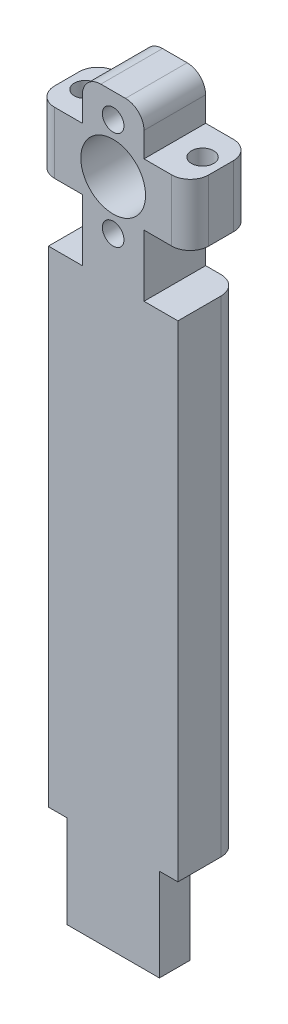
from build123d import *

# Parameters (mm, degrees)
SKETCH_1_W          = 7.5
SKETCH_1_H          = 10
SKETCH_1_W_2        = 10
SKETCH_1_H_2        = 7
EXTRUDE_1_DEPTH     = 10
CUT_EXTRUDE_1_REACH = 25.351
SKETCH_2_R          = 1.8
CUT_EXTRUDE_2_REACH = 23.937
SKETCH_3_R          = 5.25
FILLET_1_R          = 3
CUT_EXTRUDE_4_REACH = 23.937
SKETCH_5_R          = 1.75
SKETCH_6_W          = 15
SKETCH_6_H          = 10
EXTRUDE_2_DEPTH     = 93.8
SKETCH_7_W          = 21
SKETCH_7_H          = 78.8
EXTRUDE_3_DEPTH     = 10
FILLET_2_R          = 3
SKETCH_8_W          = 15
SKETCH_8_H          = 15
CUT_EXTRUDE_5_DEPTH = 5
FILLET_3_R          = 3


with BuildPart() as part:
    # 草图1 → 凸台-拉伸1 (new body)
    with BuildSketch(Plane.XY):
        with Locations((-8.75, 0)):
            Rectangle(SKETCH_1_W, SKETCH_1_H)
        Rectangle(SKETCH_1_W_2, SKETCH_1_H)
        with Locations((0, 8.5)):
            Rectangle(SKETCH_1_W_2, SKETCH_1_H_2)
        with Locations((8.75, 0)):
            Rectangle(SKETCH_1_W, SKETCH_1_H)
        with Locations((0, -10)):
            Rectangle(SKETCH_1_W_2, SKETCH_1_H)
    extrude(amount=EXTRUDE_1_DEPTH)

    # 草图2 → 切除-拉伸1 (cut, up to next)
    with BuildSketch(Plane.XZ.offset(5), mode=Mode.PRIVATE) as cut_extrude_1_sk1:
        with Locations(Location((-9.5, 5, 0), (0, 0, 270))):
            Circle(SKETCH_2_R)
    cut_extrude_1_tool1 = extrude(cut_extrude_1_sk1.sketch, amount=-CUT_EXTRUDE_1_REACH, mode=Mode.PRIVATE) & part.part
    # 草图2 → 切除-拉伸1 (cut, up to next)
    with BuildSketch(Plane.XZ.offset(5), mode=Mode.PRIVATE) as cut_extrude_1_sk2:
        with Locations(Location((9.5, 5, 0), (0, 0, 90))):
            Circle(SKETCH_2_R)
    cut_extrude_1_tool2 = extrude(cut_extrude_1_sk2.sketch, amount=-CUT_EXTRUDE_1_REACH, mode=Mode.PRIVATE) & part.part
    add(cut_extrude_1_tool1.solids().sort_by_distance((-9.5, -5, 5))[0], mode=Mode.SUBTRACT)
    add(cut_extrude_1_tool2.solids().sort_by_distance((9.5, -5, 5))[0], mode=Mode.SUBTRACT)

    # 草图3 → 切除-拉伸2 (cut, up to next)
    with BuildSketch(Plane(origin=(0, 0, 0), x_dir=(-1, 0, 0), z_dir=(0, 0, -1)), mode=Mode.PRIVATE) as cut_extrude_2_sk1:
        Circle(SKETCH_3_R)
    cut_extrude_2_tool1 = extrude(cut_extrude_2_sk1.sketch, amount=-CUT_EXTRUDE_2_REACH, mode=Mode.PRIVATE) & part.part
    add(cut_extrude_2_tool1.solids().sort_by_distance((0, 0, 0))[0], mode=Mode.SUBTRACT)

    # 圆角1
    fillet_1_edges = [part.edges().sort_by_distance(p)[0] for p in [
        (12.5, 0, 0),
        (-12.5, 0, 0),
        (12.5, 0, 10),
        (-12.5, 0, 10),
    ]]
    fillet(fillet_1_edges, radius=FILLET_1_R)

    # 草图5 → 切除-拉伸4 (cut, up to next)
    with BuildSketch(Plane.XY.offset(10), mode=Mode.PRIVATE) as cut_extrude_4_sk1:
        with Locations((0, 8)):
            Circle(SKETCH_5_R)
    cut_extrude_4_tool1 = extrude(cut_extrude_4_sk1.sketch, amount=-CUT_EXTRUDE_4_REACH, mode=Mode.PRIVATE) & part.part
    # 草图5 → 切除-拉伸4 (cut, up to next)
    with BuildSketch(Plane.XY.offset(10), mode=Mode.PRIVATE) as cut_extrude_4_sk2:
        with Locations((0, -8)):
            Circle(SKETCH_5_R)
    cut_extrude_4_tool2 = extrude(cut_extrude_4_sk2.sketch, amount=-CUT_EXTRUDE_4_REACH, mode=Mode.PRIVATE) & part.part
    add(cut_extrude_4_tool1.solids().sort_by_distance((0, 8, 10))[0], mode=Mode.SUBTRACT)
    add(cut_extrude_4_tool2.solids().sort_by_distance((0, -8, 10))[0], mode=Mode.SUBTRACT)

    # 草图6 → 凸台-拉伸2 (add)
    with BuildSketch(Plane.XZ.offset(15)):
        with Locations((0, 5)):
            Rectangle(SKETCH_6_W, SKETCH_6_H)
    extrude(amount=EXTRUDE_2_DEPTH)

    # 草图7 → 凸台-拉伸3 (add)
    with BuildSketch(Plane(origin=(0, 0, 0), x_dir=(-1, 0, 0), z_dir=(0, 0, -1))):
        with Locations((0, -54.4)):
            Rectangle(SKETCH_7_W, SKETCH_7_H)
    extrude(amount=-EXTRUDE_3_DEPTH)

    # 圆角2
    fillet_2_edges = [part.edges().sort_by_distance(p)[0] for p in [
        (-10.5, -54.4, 0),
        (10.5, -54.4, 0),
    ]]
    fillet(fillet_2_edges, radius=FILLET_2_R)

    # 草图8 → 切除-拉伸5 (cut)
    with BuildSketch(Plane(origin=(0, 0, 0), x_dir=(-1, 0, 0), z_dir=(0, 0, -1))):
        with Locations((0, -101.3)):
            Rectangle(SKETCH_8_W, SKETCH_8_H)
    extrude(amount=-CUT_EXTRUDE_5_DEPTH, mode=Mode.SUBTRACT)

    # 圆角3
    fillet_3_edges = [part.edges().sort_by_distance(p)[0] for p in [
        (-5, 12, 5),
        (5, 12, 5),
    ]]
    fillet(fillet_3_edges, radius=FILLET_3_R)


solid = part.part
